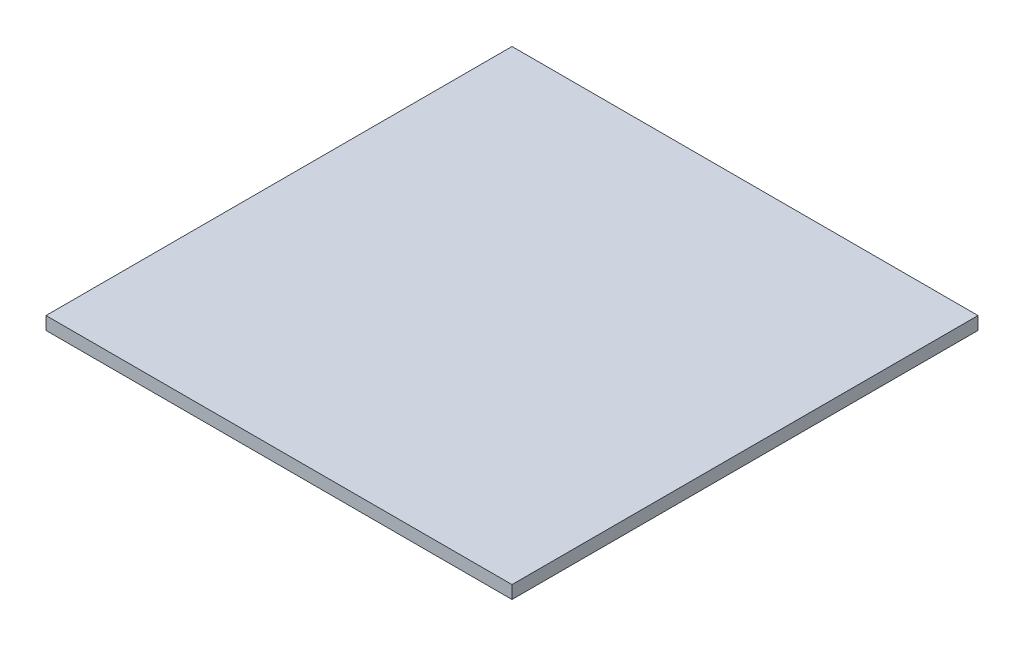
from build123d import *

# Parameters (mm, degrees)
SKETCH1_W           = 457.2
SKETCH1_H           = 457.2
BOSS_EXTRUDE1_DEPTH = 12.7


with BuildPart() as part:
    # Sketch1 → Boss-Extrude1 (new body)
    with BuildSketch(Plane(origin=(0, 0, 0), x_dir=(1, 0, 0), z_dir=(0, 1, 0))):
        Rectangle(SKETCH1_W, SKETCH1_H)
    extrude(amount=BOSS_EXTRUDE1_DEPTH)


solid = part.part
